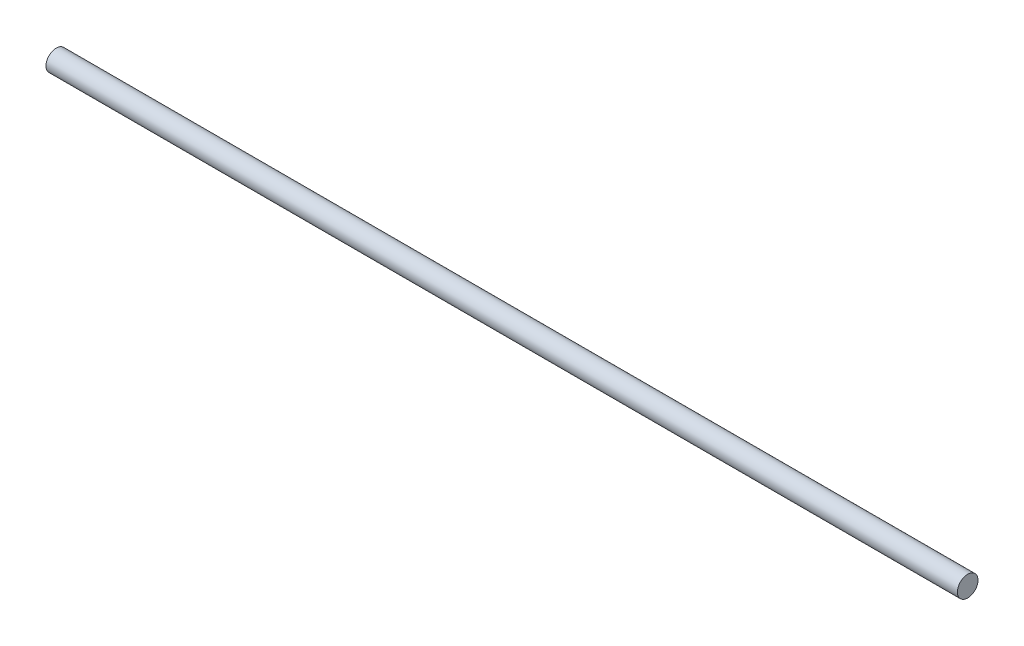
from build123d import *

# Parameters (mm, degrees)
SKETCH2_R           = 3.175
BOSS_EXTRUDE2_DEPTH = 280.747487714


with BuildPart() as part:
    # Sketch2 → Boss-Extrude2 (new body)
    with BuildSketch(Plane(origin=(0, 0, 0), x_dir=(0, 0, -1), z_dir=(1, 0, 0))):
        Circle(SKETCH2_R)
    extrude(amount=BOSS_EXTRUDE2_DEPTH)


solid = part.part
